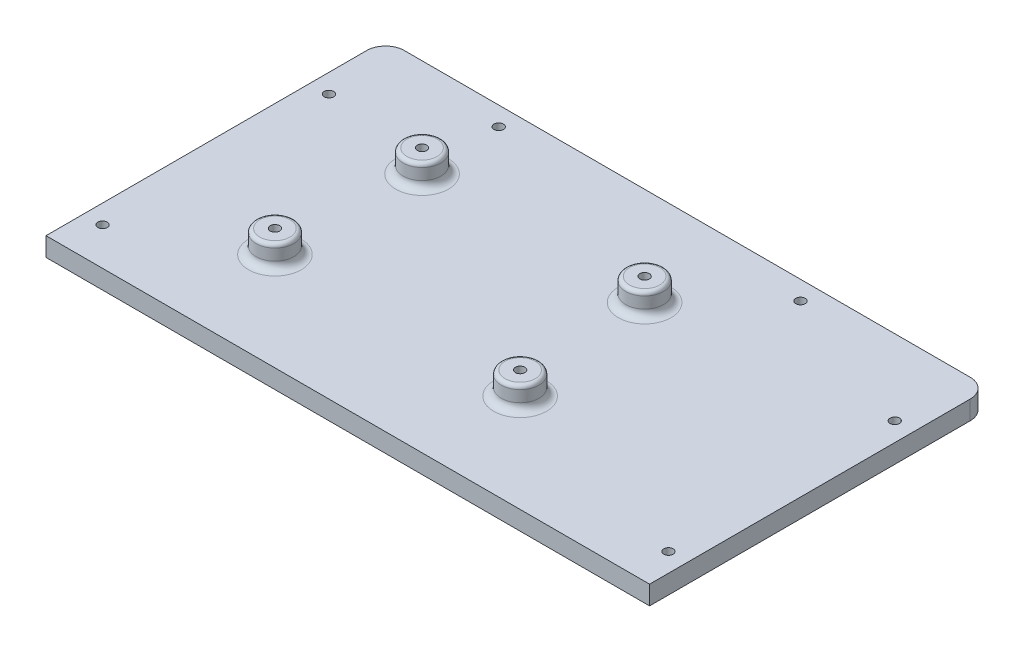
from build123d import *

# Parameters (mm, degrees)
SKETCH1_R           = 1.5875
BOSS_EXTRUDE1_DEPTH = 6.35
SKETCH2_R           = 6.35
BOSS_EXTRUDE2_DEPTH = 7.62
FILLET1_R           = 2.54
FILLET2_R           = 1.27
SKETCH5_R           = 1.5875
CUT_EXTRUDE1_DEPTH  = 234.559180723


with BuildPart() as part:
    # Sketch1 → Boss-Extrude1 (new body)
    with BuildSketch(Plane(origin=(0, 0, 0), x_dir=(1, 0, 0), z_dir=(0, 1, 0))):
        with BuildLine():
            Line((0, 0), (203.2, 0))
            Line((203.2, 0), (203.2, 107.95))
            ThreePointArc((203.2, 107.95), (201.340128061, 112.440128061), (196.85, 114.3))
            Line((196.85, 114.3), (6.35, 114.3))
            ThreePointArc((6.35, 114.3), (1.859871939, 112.440128061), (0, 107.95))
            Line((0, 107.95), (0, 0))
        make_face()
        with Locations(Location((6.35, 12.7, 0), (0, 0, 270))):
            Circle(SKETCH1_R, mode=Mode.SUBTRACT)
        with Locations(Location((196.85, 88.9, 0), (0, 0, 90))):
            Circle(SKETCH1_R, mode=Mode.SUBTRACT)
        with Locations(Location((6.35, 88.9, 0), (0, 0, 270))):
            Circle(SKETCH1_R, mode=Mode.SUBTRACT)
        with Locations(Location((44.45, 107.95, 0), (0, 0, 270))):
            Circle(SKETCH1_R, mode=Mode.SUBTRACT)
        with Locations(Location((146.05, 107.95, 0), (0, 0, 270))):
            Circle(SKETCH1_R, mode=Mode.SUBTRACT)
        with Locations(Location((196.85, 12.7, 0), (0, 0, 90))):
            Circle(SKETCH1_R, mode=Mode.SUBTRACT)
    extrude(amount=BOSS_EXTRUDE1_DEPTH)

    # Sketch2 → Boss-Extrude2 (add)
    with BuildSketch(Plane(origin=(0, 6.35, 0), x_dir=(1, 0, 0), z_dir=(0, 1, 0))):
        with Locations(Location((45.295058165, 81.306998134, 0), (0, 0, 90))):
            Circle(SKETCH2_R)
        with Locations(Location((120.225058165, 81.306998134, 0), (0, 0, 90))):
            Circle(SKETCH2_R)
        with Locations(Location((44.025058165, 33.046998134, 0), (0, 0, 90))):
            Circle(SKETCH2_R)
        with Locations(Location((126.575058165, 33.046998134, 0), (0, 0, 90))):
            Circle(SKETCH2_R)
    extrude(amount=BOSS_EXTRUDE2_DEPTH)

    # Fillet1
    fillet1_edges = [part.edges().sort_by_distance(p)[0] for p in [
        (45.295058165, 6.35, -74.956998134),
        (120.225058165, 6.35, -74.956998134),
        (44.025058165, 6.35, -26.696998134),
        (126.575058165, 6.35, -26.696998134),
    ]]
    fillet(fillet1_edges, radius=FILLET1_R)

    # Fillet2
    fillet2_edges = [part.edges().sort_by_distance(p)[0] for p in [
        (45.295058165, 13.97, -74.956998134),
        (120.225058165, 13.97, -74.956998134),
        (44.025058165, 13.97, -26.696998134),
        (126.575058165, 13.97, -26.696998134),
    ]]
    fillet(fillet2_edges, radius=FILLET2_R)

    # Sketch5 → Cut-Extrude1 (cut, through all)
    with BuildSketch(Plane(origin=(0, 13.97, 0), x_dir=(1, 0, 0), z_dir=(0, 1, 0))):
        with Locations(Location((45.295058165, 81.306998134, 0), (0, 0, 270))):
            Circle(SKETCH5_R)
        with Locations(Location((120.225058165, 81.306998134, 0), (0, 0, 270))):
            Circle(SKETCH5_R)
        with Locations(Location((126.575058165, 33.046998134, 0), (0, 0, 270))):
            Circle(SKETCH5_R)
        with Locations(Location((44.025058165, 33.046998134, 0), (0, 0, 270))):
            Circle(SKETCH5_R)
    extrude(amount=-CUT_EXTRUDE1_DEPTH, mode=Mode.SUBTRACT)


solid = part.part
